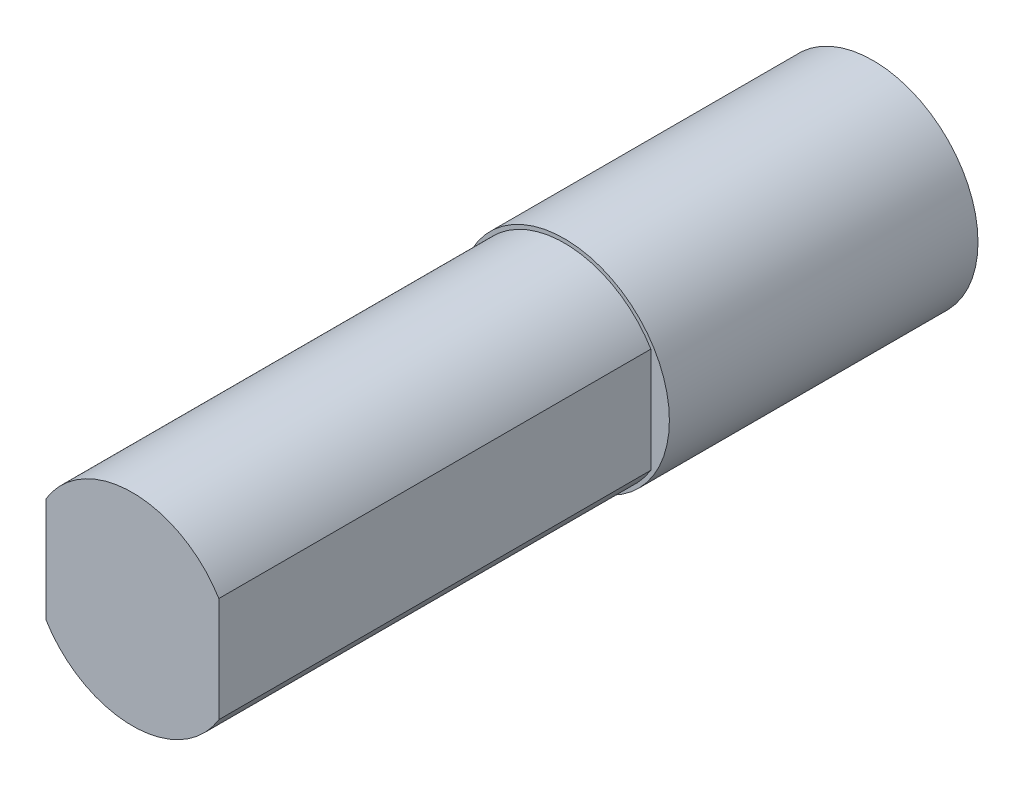
from build123d import *

# Parameters (mm, degrees)
SKETCH2_R           = 3.4
BOSS_EXTRUDE1_DEPTH = 8
SKETCH3_R           = 3.4
BOSS_EXTRUDE2_DEPTH = 2
BOSS_EXTRUDE3_DEPTH = 14


with BuildPart() as part:
    # Sketch2 → Boss-Extrude1 (new body)
    with BuildSketch(Plane.XY):
        Circle(SKETCH2_R)
        with BuildLine():
            Line((-1.7, -1.316244658), (-1.7, 1.316244658))
            ThreePointArc((-1.7, 1.316244658), (2.15, 0), (-1.7, -1.316244658))
        make_face(mode=Mode.SUBTRACT)
    extrude(amount=BOSS_EXTRUDE1_DEPTH)

    # Sketch3 → Boss-Extrude2 (add)
    with BuildSketch(Plane.XY.offset(8)):
        Circle(SKETCH3_R)
    extrude(amount=BOSS_EXTRUDE2_DEPTH)

    # Sketch4 → Boss-Extrude3 (add)
    with BuildSketch(Plane.XY.offset(10)):
        with BuildLine():
            Line((-2.8, -1.7), (-2.8, 1.7))
            ThreePointArc((-2.8, 1.7), (0, 3.275667871), (2.8, 1.7))
            Line((2.8, 1.7), (2.8, -1.7))
            ThreePointArc((2.8, -1.7), (0, -3.275667871), (-2.8, -1.7))
        make_face()
    extrude(amount=BOSS_EXTRUDE3_DEPTH)


solid = part.part
